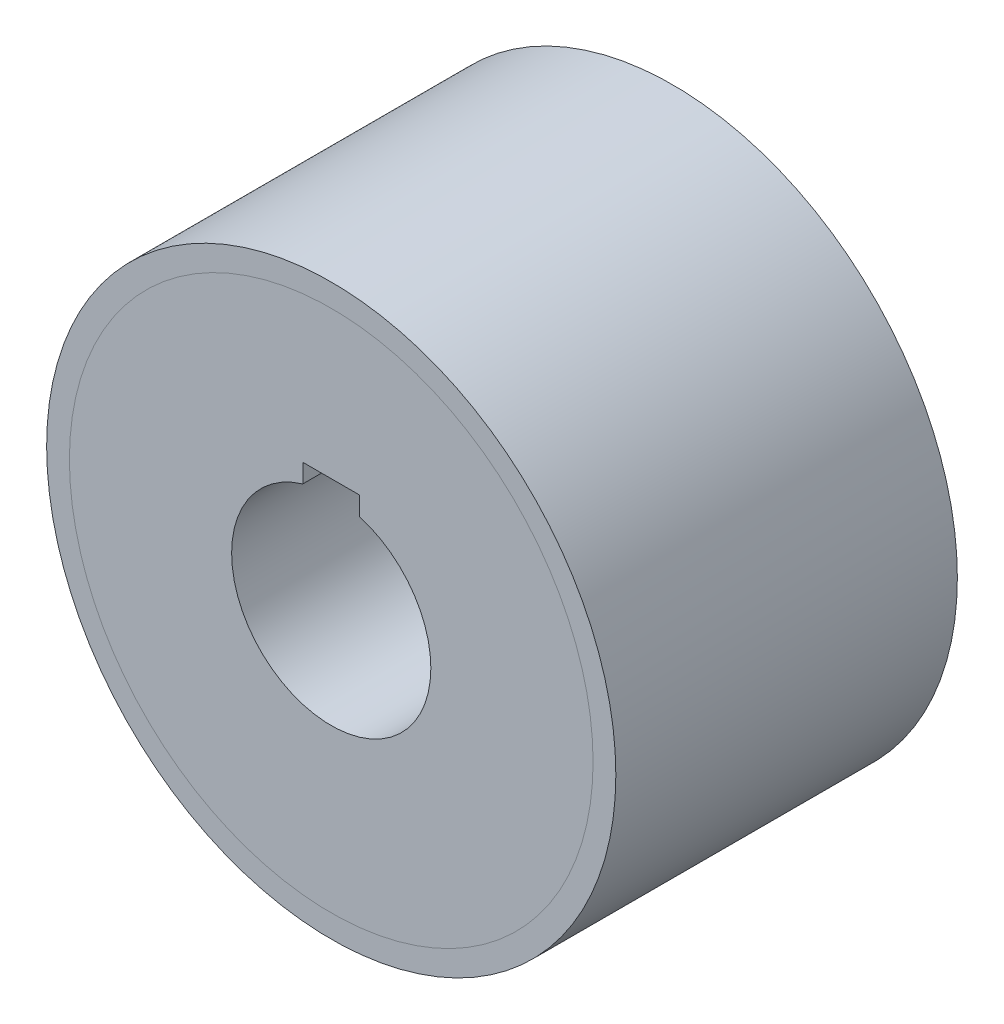
from build123d import *

# Parameters (mm, degrees)
SKETCH1_R           = 46
BOSS_EXTRUDE1_DEPTH = 60
SKETCH2_R           = 17.5
CUT_EXTRUDE1_DEPTH  = 89.498587559
CUT_EXTRUDE2_DEPTH  = 89.498587559
SKETCH4_R           = 50
SKETCH4_R_2         = 46
BOSS_EXTRUDE2_DEPTH = 60


with BuildPart() as part:
    # Sketch1 → Boss-Extrude1 (new body)
    with BuildSketch(Plane.XY):
        Circle(SKETCH1_R)
    extrude(amount=BOSS_EXTRUDE1_DEPTH)

    # Sketch2 → Cut-Extrude1 (cut, through all)
    with BuildSketch(Plane(origin=(0, 0, 0), x_dir=(-1, 0, 0), z_dir=(0, 0, -1))):
        Circle(SKETCH2_R)
    extrude(amount=-CUT_EXTRUDE1_DEPTH, mode=Mode.SUBTRACT)

    # Sketch3 → Cut-Extrude2 (cut, through all)
    with BuildSketch(Plane(origin=(0, 0, 0), x_dir=(-1, 0, 0), z_dir=(0, 0, -1))):
        with BuildLine():
            Line((-5, 16.770509831), (-5, 20.070509831))
            Line((-5, 20.070509831), (5, 20.070509831))
            Line((5, 20.070509831), (5, 16.770509831))
            ThreePointArc((5, 16.770509831), (0, 17.5), (-5, 16.770509831))
        make_face()
    extrude(amount=-CUT_EXTRUDE2_DEPTH, mode=Mode.SUBTRACT)


with BuildPart() as body_2:
    # Sketch4 → Boss-Extrude2 (new body)
    with BuildSketch(Plane(origin=(0, 0, 0), x_dir=(-1, 0, 0), z_dir=(0, 0, -1))):
        Circle(SKETCH4_R)
        Circle(SKETCH4_R_2, mode=Mode.SUBTRACT)
    extrude(amount=-BOSS_EXTRUDE2_DEPTH)


solid = Compound([part.part, body_2.part])
